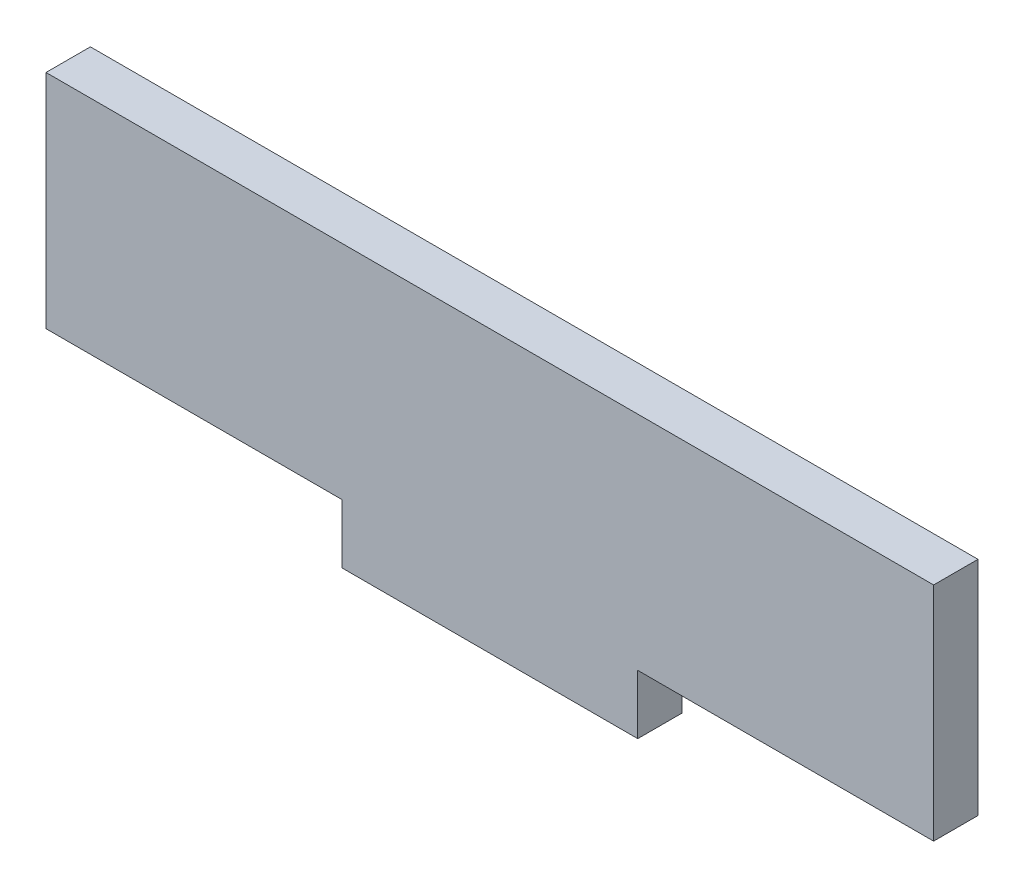
from build123d import *

# Parameters (mm, degrees)
BOSS_EXTRUDE1_DEPTH = 3


with BuildPart() as part:
    # Sketch1 → Boss-Extrude1 (new body)
    with BuildSketch(Plane.XY):
        Polygon((0, 0), (0, 15), (60, 15), (60, 0), (40, 0), (40, -4), (20, -4), (20, 0), align=None)
    extrude(amount=BOSS_EXTRUDE1_DEPTH)


solid = part.part
